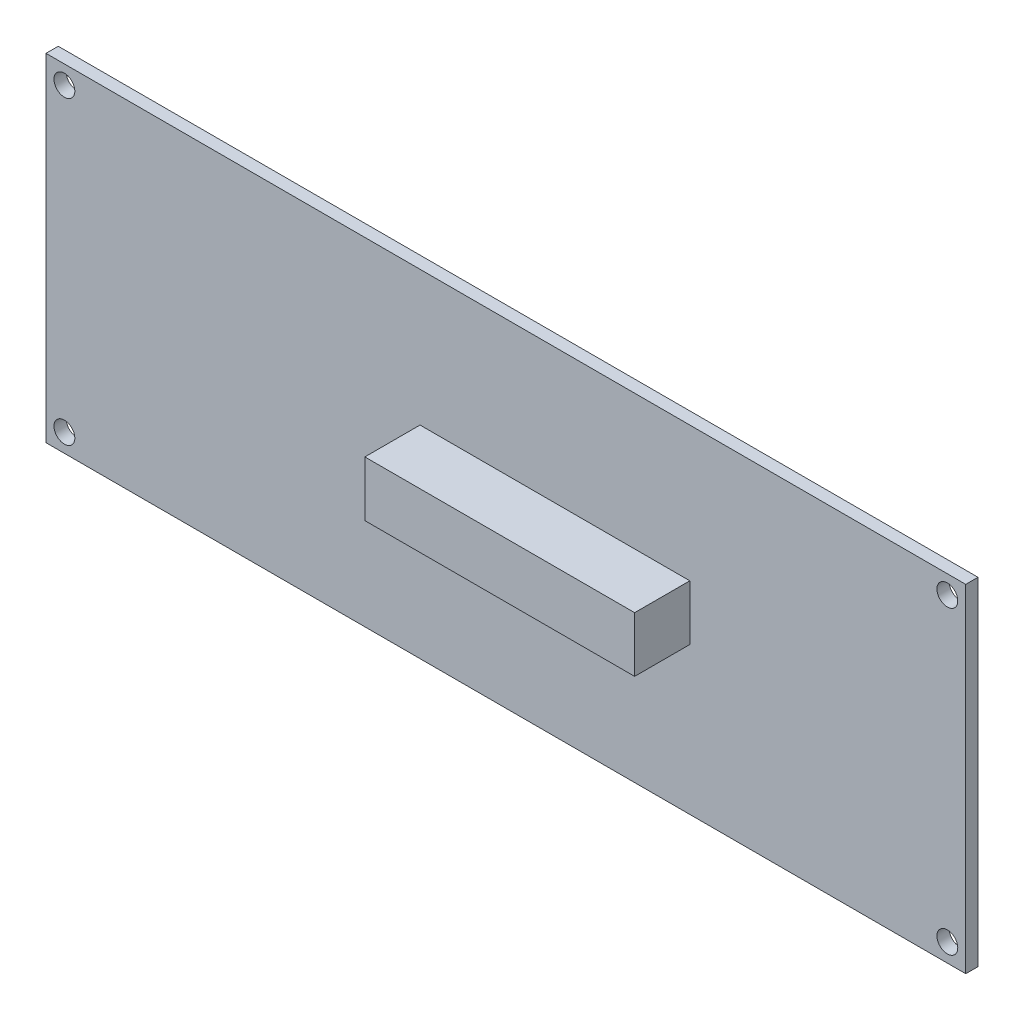
from build123d import *

# Parameters (mm, degrees)
SKETCH_1_W      = 150
SKETCH_1_H      = 55
SKETCH_1_R      = 1.7
EXTRUDE_1_DEPTH = 2
SKETCH_2_W      = 44
SKETCH_2_H      = 9
EXTRUDE_2_DEPTH = 9


with BuildPart() as part:
    # 草圖1 → 填料-伸長1 (new body)
    with BuildSketch(Plane.XY):
        Rectangle(SKETCH_1_W, SKETCH_1_H)
        with Locations((-72, 24.5)):
            Circle(SKETCH_1_R, mode=Mode.SUBTRACT)
        with Locations(Location((72, 24.5, 0), (0, 0, 180))):
            Circle(SKETCH_1_R, mode=Mode.SUBTRACT)
        with Locations((72, -24.5)):
            Circle(SKETCH_1_R, mode=Mode.SUBTRACT)
        with Locations(Location((-72, -24.5, 0), (0, 0, 180))):
            Circle(SKETCH_1_R, mode=Mode.SUBTRACT)
    extrude(amount=EXTRUDE_1_DEPTH)

    # 草圖2 → 填料-伸長2 (add)
    with BuildSketch(Plane.XY.offset(2)):
        with Locations((8, 1)):
            Rectangle(SKETCH_2_W, SKETCH_2_H)
    extrude(amount=EXTRUDE_2_DEPTH)


solid = part.part
